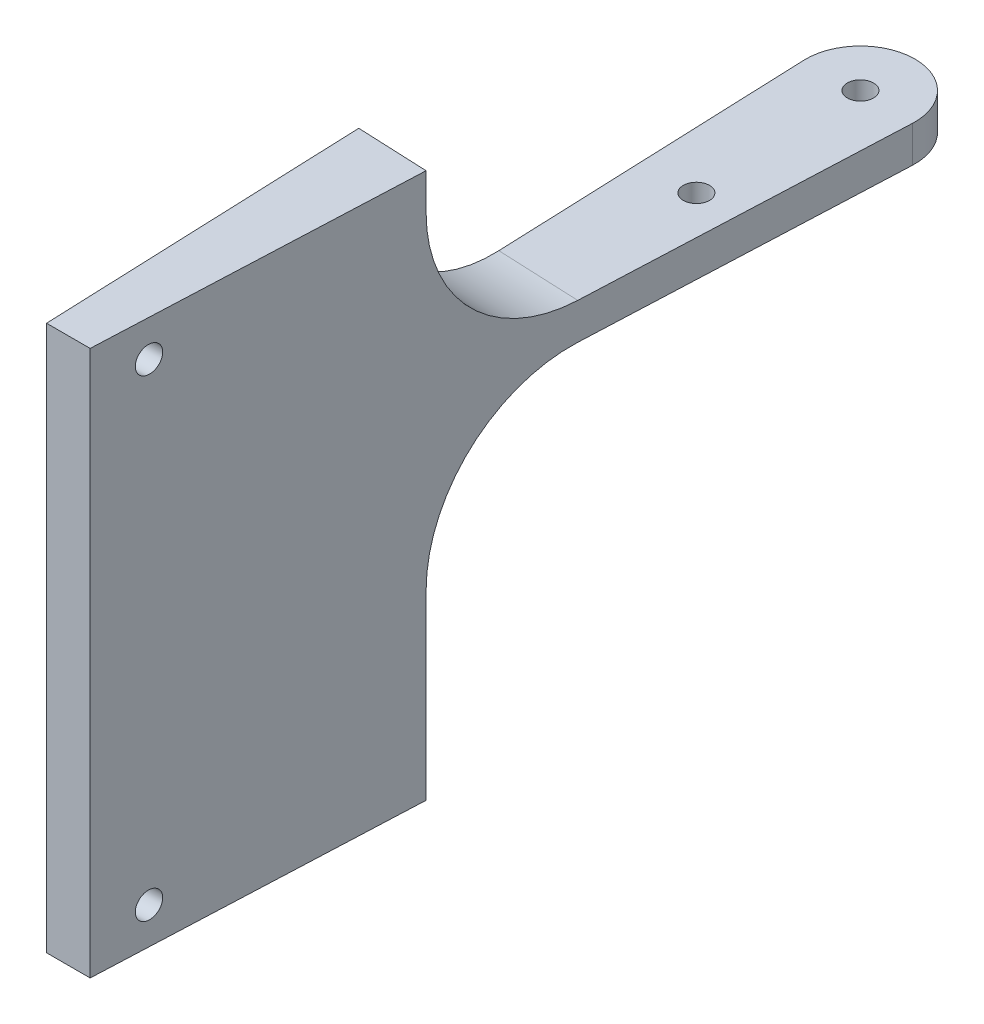
from build123d import *
from build123d.topology import SkipClean

# Parameters (mm, degrees)
BOSS_EXTRUDE1_DEPTH      = 5
BOSS_EXTRUDE2_DEPTH      = 25
BOSS_EXTRUDE2_DEPTH_BACK = 50
FILLET1_R                = 20
SKETCH3_R                = 1.8
CUT_EXTRUDE1_DEPTH       = 19
SKETCH4_R                = 1.8
CUT_EXTRUDE2_DEPTH       = 10


with BuildPart() as part:
    # Sketch1 → Boss-Extrude1 (new body)
    with SkipClean():  # the faces are left unmerged after this step: merging them gives an invalid solid
        with BuildSketch(Plane(origin=(0, 0, 0), x_dir=(1, 0, 0), z_dir=(0, 1, 0))):
            with BuildLine():
                ThreePointArc((0, -0.740747083), (-3.176101933, -3.632802831), (-4.24425851, -7.793409934))
                Line((-4.24425851, -7.793409934), (0, -14.259252917))
                Line((0, -14.259252917), (0, -0.740747083))
            make_face()
            with BuildLine():
                Line((6, -0.522357132), (6, -14.477642868))
                Line((6, -14.477642868), (10.742827875, -7.827918338))
                ThreePointArc((10.742827875, -7.827918338), (10.748206754, -7.663998381), (10.75, -7.5))
                ThreePointArc((10.75, -7.5), (9.449798384, -3.279514246), (6, -0.522357132))
            make_face()
            with BuildLine():
                Line((0, -0.740747083), (0, -14.259252917))
                ThreePointArc((0, -14.259252917), (2.977193214, -14.995036788), (6, -14.477642868))
                Line((6, -14.477642868), (6, -0.522357132))
                ThreePointArc((6, -0.522357132), (4.649585383, -0.131746424), (3.25, 0))
                ThreePointArc((3.25, 0), (1.583326199, -0.187531303), (0, -0.740747083))
            make_face()
            with BuildLine():
                ThreePointArc((0, -14.259252917), (-3.019892671, -11.615634325), (-4.24425851, -7.793409934))
                Line((-4.24425851, -7.793409934), (0, -116.2))
                Line((0, -116.2), (0, -14.259252917))
            make_face()
            with BuildLine():
                Line((6, -14.477642868), (6, -116.2))
                Line((6, -116.2), (10.742827875, -7.827918338))
                ThreePointArc((10.742827875, -7.827918338), (9.356028972, -11.855044225), (6, -14.477642868))
            make_face()
            with BuildLine():
                Line((0, -14.259252917), (0, -116.2))
                Line((0, -116.2), (6, -116.2))
                Line((6, -116.2), (6, -14.477642868))
                ThreePointArc((6, -14.477642868), (2.977193214, -14.995036788), (0, -14.259252917))
            make_face()
            with BuildLine():
                Line((10.742827875, -7.827918338), (6, -14.477642868))
                ThreePointArc((6, -14.477642868), (9.356028972, -11.855044225), (10.742827875, -7.827918338))
            make_face()
            with BuildLine():
                Line((0, -14.259252917), (-4.24425851, -7.793409934))
                ThreePointArc((-4.24425851, -7.793409934), (-3.019892671, -11.615634325), (0, -14.259252917))
            make_face()
        extrude(amount=BOSS_EXTRUDE1_DEPTH)

    # Sketch2 → Boss-Extrude2 (add, two sides: drawn at the far end of the back side and taken through both)
    with BuildSketch(Plane(origin=(0, 5, 0), x_dir=(1, 0, 0), z_dir=(0, 1, 0)).offset(-BOSS_EXTRUDE2_DEPTH_BACK)):
        Polygon((-1.749928594, -71.503431366), (7.937559289, -71.927397454), (6, -116.2), (0, -116.2), align=None)
    extrude(amount=BOSS_EXTRUDE2_DEPTH + BOSS_EXTRUDE2_DEPTH_BACK)

    # Fillet1
    fillet1_edges = [part.edges().sort_by_distance(p)[0] for p in [
        (3.093815347, 5, 71.71541441),
        (3.093815347, 0, 71.71541441),
    ]]
    fillet(fillet1_edges, radius=FILLET1_R)

    # Sketch3 → Cut-Extrude1 (cut)
    with BuildSketch(Plane(origin=(0, 5, 0), x_dir=(1, 0, 0), z_dir=(0, 1, 0))):
        with Locations(Location((3.25, -7.5, 0), (0, 0, 270))):
            Circle(SKETCH3_R)
        with Locations(Location((4.169351127, -30.982009997, 0), (0, 0, 270))):
            Circle(SKETCH3_R)
    extrude(amount=-CUT_EXTRUDE1_DEPTH, mode=Mode.SUBTRACT)

    # Sketch4 → Cut-Extrude2 (cut)
    with BuildSketch(Plane(origin=(-4.542417883, 0, 0.177841548), x_dir=(0.03912132455492767, 0, 0.9992344679628841), z_dir=(-0.9992344679628841, 0, 0.03912132455492767))):
        with Locations((108.611045177, -40)):
            Circle(SKETCH4_R)
        with Locations((108.611045177, 25)):
            Circle(SKETCH4_R)
    extrude(amount=-CUT_EXTRUDE2_DEPTH, mode=Mode.SUBTRACT)


solid = part.part
